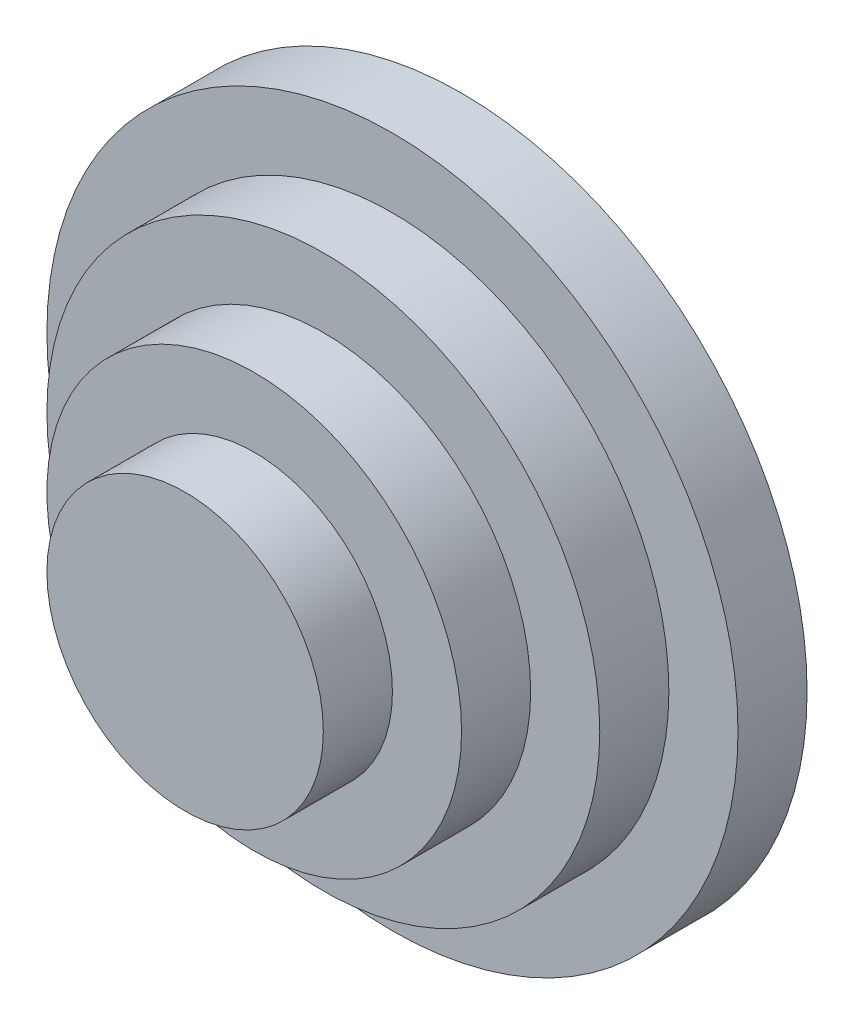
from build123d import *

# Parameters (mm, degrees)
SKETCH_1_R      = 25
EXTRUDE_1_DEPTH = 5
SKETCH_2_R      = 20
EXTRUDE_2_DEPTH = 5
SKETCH_3_R      = 15
EXTRUDE_3_DEPTH = 5
SKETCH_4_R      = 10
EXTRUDE_4_DEPTH = 5


with BuildPart() as part:
    # Эскиз1 → Бобышка-Вытянуть1 (new body)
    with BuildSketch(Plane.XY):
        Circle(SKETCH_1_R)
    extrude(amount=EXTRUDE_1_DEPTH)

    # Эскиз2 → Бобышка-Вытянуть2 (add)
    with BuildSketch(Plane.XY.offset(5)):
        Circle(SKETCH_2_R)
    extrude(amount=EXTRUDE_2_DEPTH)

    # Эскиз3 → Бобышка-Вытянуть3 (add)
    with BuildSketch(Plane.XY.offset(10)):
        Circle(SKETCH_3_R)
    extrude(amount=EXTRUDE_3_DEPTH)

    # Эскиз4 → Бобышка-Вытянуть4 (add)
    with BuildSketch(Plane.XY.offset(15)):
        Circle(SKETCH_4_R)
    extrude(amount=EXTRUDE_4_DEPTH)


solid = part.part
